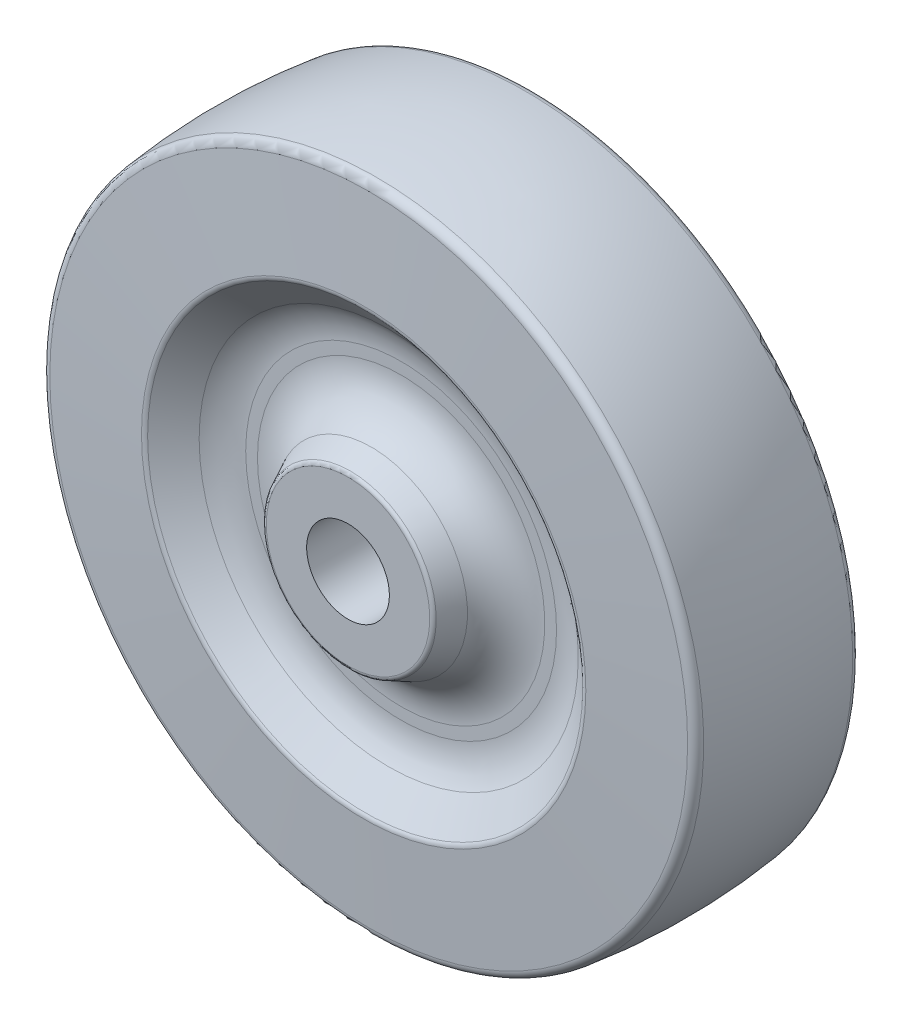
from build123d import *

# Parameters (mm, degrees)
SKETCH3_W               = 23.6474
SKETCH3_H               = 4.7498
SKETCH6_W               = 23.6474
SKETCH6_H               = 4.7498
CUT_EXTRUDE1_DEPTH      = 56.163574004
CUT_EXTRUDE1_DEPTH_BACK = 56.163574004
SKETCH4_R               = 3.175
FILLET1_R               = 1.016
FILLET2_R               = 6.096
FILLET3_R               = 0.762
FILLET4_R               = 0.508
SKETCH10_R              = 4.7498
CUT_EXTRUDE2_DEPTH      = 59.842327809


with BuildPart() as part:
    # Sketch2 → Revolve1 (revolve)
    with BuildSketch(Plane(origin=(0, 0, 0), x_dir=(0, 0, -1), z_dir=(1, 0, 0)), mode=Mode.PRIVATE) as revolve1_sk:
        with BuildLine():
            Line((10.0457, 25.211992013), (5.7277, 20.066))
            Line((5.7277, 20.066), (5.7277, 12.7))
            Line((5.7277, 12.7), (11.8237, 9.7028))
            Line((11.8237, 9.7028), (11.8237, 0))
            Line((11.8237, 0), (-11.8237, 0))
            Line((-11.8237, 0), (-11.8237, 9.7028))
            Line((-11.8237, 9.7028), (-5.7277, 12.7))
            Line((-5.7277, 12.7), (-5.7277, 20.066))
            Line((-5.7277, 20.066), (-10.0457, 25.211992013))
            Line((-10.0457, 25.211992013), (-9.403592979, 37.464123841))
            ThreePointArc((-9.403592979, 37.464123841), (0, 38.1), (9.403592979, 37.464123841))
            Line((9.403592979, 37.464123841), (10.0457, 25.211992013))
        make_face()
    revolve(revolve1_sk.sketch.rotate(Axis((0, 0, 11.8237), (0, 0, -1)), 90), axis=Axis((0, 0, 11.8237), (0, 0, -1)))

    # Sketch6 → Cut-Revolve1 (revolve, cut)
    with BuildSketch(Plane(origin=(0, 0, 0), x_dir=(0, 0, -1), z_dir=(1, 0, 0)), mode=Mode.PRIVATE) as cut_revolve1_sk:
        with Locations((0, 2.3749)):
            Rectangle(SKETCH6_W, SKETCH6_H)
    revolve(cut_revolve1_sk.sketch.rotate(Axis((0, 0, 11.8237), (0, 0, -1)), 90), axis=Axis((0, 0, 11.8237), (0, 0, -1)), mode=Mode.SUBTRACT)

    # Fillet1
    fillet1_edges = [part.edges().sort_by_distance(p)[0] for p in [
        (-37.464123841, 0, -9.403592979),
        (-37.464123841, 0, 9.403592979),
    ]]
    fillet(fillet1_edges, radius=FILLET1_R)

    # Fillet2
    fillet2_edges = [part.edges().sort_by_distance(p)[0] for p in [
        (-20.066, 0, 5.7277),
        (-12.7, 0, 5.7277),
        (-12.7, 0, -5.7277),
        (-20.066, 0, -5.7277),
    ]]
    fillet(fillet2_edges, radius=FILLET2_R)

    # Fillet3
    fillet3_edges = [part.edges().sort_by_distance(p)[0] for p in [
        (-25.211992013, 0, -10.0457),
        (-25.211992013, 0, 10.0457),
    ]]
    fillet(fillet3_edges, radius=FILLET3_R)

    # Fillet4
    fillet4_edges = [part.edges().sort_by_distance(p)[0] for p in [
        (-9.7028, 0, 11.8237),
        (-9.7028, 0, -11.8237),
    ]]
    fillet(fillet4_edges, radius=FILLET4_R)


with BuildPart() as body_2:
    # Sketch3 → Revolve2 (revolve)
    with BuildSketch(Plane(origin=(0, 0, 0), x_dir=(0, 0, -1), z_dir=(1, 0, 0)), mode=Mode.PRIVATE) as revolve2_sk:
        with Locations((0, 2.3749)):
            Rectangle(SKETCH3_W, SKETCH3_H)
    revolve(revolve2_sk.sketch.rotate(Axis((0, 0, 11.8237), (0, 0, -1)), 90), axis=Axis((0, 0, 11.8237), (0, 0, -1)))

    # Sketch4 → Cut-Extrude1 (cut, two sides: drawn at the far end of the back side and taken through both)
    with BuildSketch(Plane.XY.offset(-CUT_EXTRUDE1_DEPTH_BACK)):
        Circle(SKETCH4_R)
    extrude(amount=CUT_EXTRUDE1_DEPTH + CUT_EXTRUDE1_DEPTH_BACK, mode=Mode.SUBTRACT)

    # Sketch10 → Cut-Extrude2 (cut, through all)
    with BuildSketch(Plane(origin=(0, 0, -11.8237), x_dir=(-1, 0, 0), z_dir=(0, 0, -1))):
        with Locations(Location((0, 0, 0), (0, 0, 180))):
            Circle(SKETCH10_R)
    extrude(amount=-CUT_EXTRUDE2_DEPTH, mode=Mode.SUBTRACT)


solid = part.part
